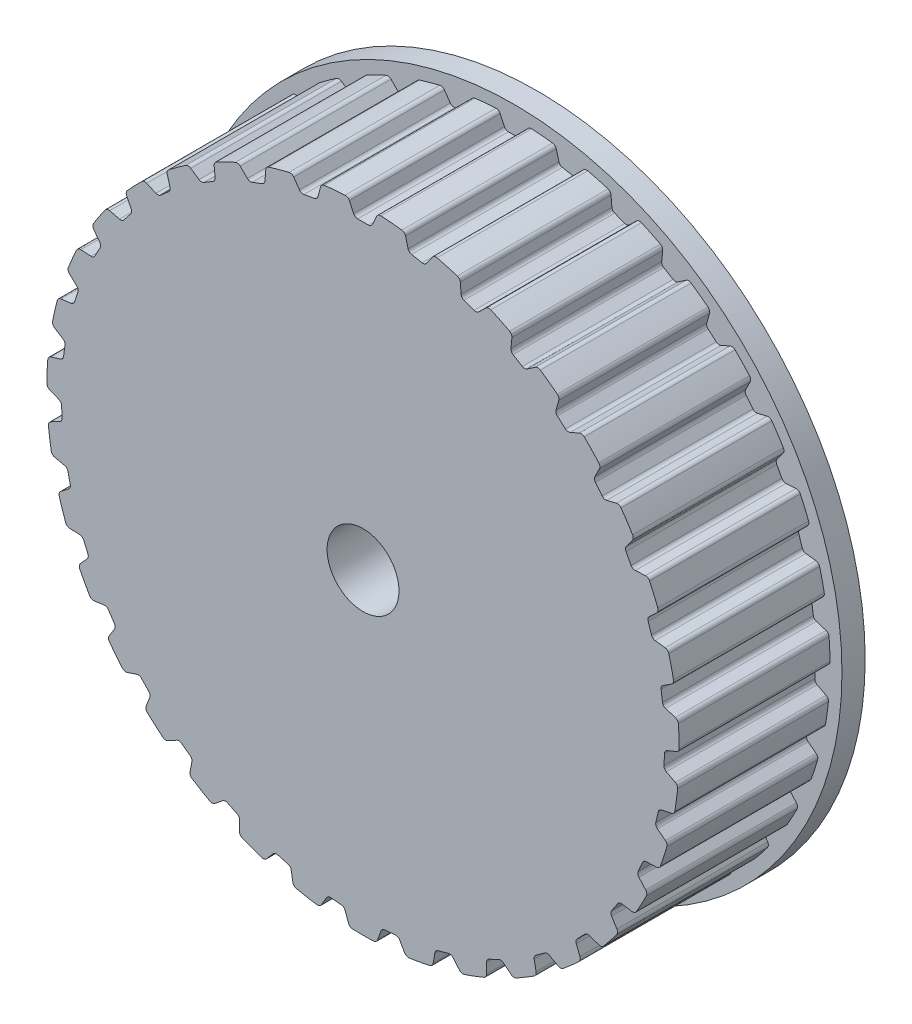
from build123d import *

# Parameters (mm, degrees)
BOSS_EXTRUDE1_DEPTH      = 13
BOSS_EXTRUDE1_DEPTH_BACK = 2
SKETCH1_R                = 28.297748882
CUT_EXTRUDE1_DEPTH       = 13
CIRPATTERN2_COUNT        = 35
CUT_EXTRUDE2_DEPTH       = 43.737865922
CUT_EXTRUDE2_DEPTH_BACK  = 43.737865922
SKETCH6_R                = 3.1


with BuildPart() as part:
    # Sketch1 → Boss-Extrude1 (new, two sides: drawn at the far end of the back side and taken through both)
    with BuildSketch(Plane.XY.offset(-BOSS_EXTRUDE1_DEPTH_BACK)):
        Circle(SKETCH1_R)
    extrude(amount=BOSS_EXTRUDE1_DEPTH + BOSS_EXTRUDE1_DEPTH_BACK)

    # Sketch2 → Cut-Extrude1 (cut)
    with BuildSketch(Plane.XY.offset(13)):
        with BuildLine():
            Line((0.464829279, 25.997748882), (-0.464829279, 25.997748882))
            ThreePointArc((-0.464829279, 25.997748882), (-0.66900313, 26.057260132), (-0.809226238, 26.217153942))
            Line((-0.809226238, 26.217153942), (-1.176736132, 27.005281454))
            ThreePointArc((-1.176736132, 27.005281454), (-1.326110217, 27.170824642), (-1.542631008, 27.224077921))
            ThreePointArc((-1.542631008, 27.224077921), (-1.993720549, 27.194764339), (-2.444262165, 27.157976941))
            Line((-2.444262165, 27.157976941), (-2.536590653, 28.183830464))
            ThreePointArc((-2.536590653, 28.183830464), (0, 28.297748882), (2.536590653, 28.183830464))
            Line((2.536590653, 28.183830464), (2.444262165, 27.157976941))
            ThreePointArc((2.444262165, 27.157976941), (1.993720549, 27.194764339), (1.542631008, 27.224077921))
            ThreePointArc((1.542631008, 27.224077921), (1.326110217, 27.170824642), (1.176736132, 27.005281454))
            Line((1.176736132, 27.005281454), (0.809226238, 26.217153942))
            ThreePointArc((0.809226238, 26.217153942), (0.66900313, 26.057260132), (0.464829279, 25.997748882))
        make_face()
    cut_extrude1 = extrude(amount=-CUT_EXTRUDE1_DEPTH, mode=Mode.SUBTRACT)

    # CirPattern2: Cut-Extrude1 ×35 about axis
    cirpattern2_axis = Axis((0, 0, 0), (0, 0, 1))
    for i in range(1, CIRPATTERN2_COUNT):
        add(cut_extrude1.rotate(cirpattern2_axis, i * 360 / CIRPATTERN2_COUNT), mode=Mode.SUBTRACT)

    # Sketch6 → Cut-Extrude2 (cut, two sides: drawn at the far end of the back side and taken through both)
    with BuildSketch(Plane.XY.offset(13).offset(-CUT_EXTRUDE2_DEPTH_BACK)):
        Circle(SKETCH6_R)
    extrude(amount=CUT_EXTRUDE2_DEPTH + CUT_EXTRUDE2_DEPTH_BACK, mode=Mode.SUBTRACT)


solid = part.part
